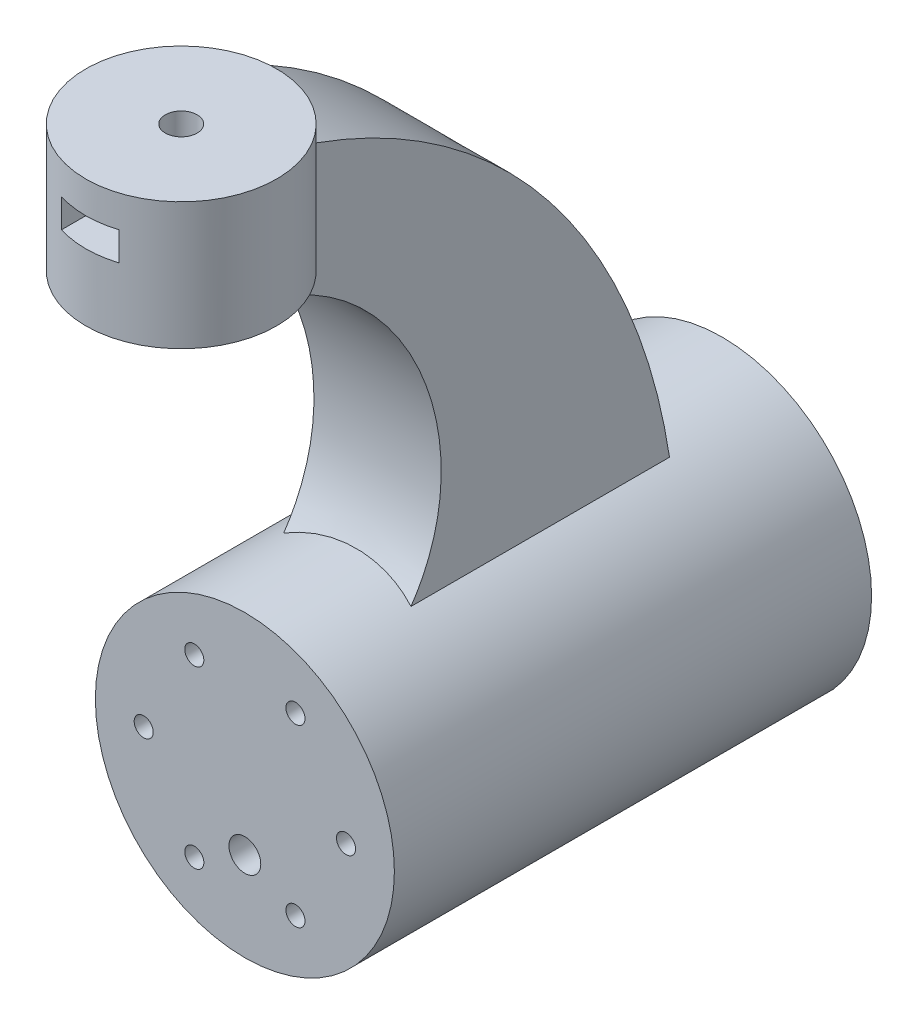
from build123d import *

# Parameters (mm, degrees)
SKETCH3_R           = 15
BOSS_EXTRUDE1_DEPTH = 20
SKETCH4_R           = 2.5
CUT_EXTRUDE1_DEPTH  = 30.154759474
CUT_EXTRUDE2_DEPTH  = 4.5
SKETCH7_W           = 9
SKETCH7_H           = 4.5
CUT_EXTRUDE3_DEPTH  = 30.154759474
BOSS_EXTRUDE3_DEPTH = 10
SKETCH9_R           = 2.5
CUT_EXTRUDE4_DEPTH  = 30
SKETCH12_R          = 23.5
BOSS_EXTRUDE6_DEPTH = 75
SKETCH13_R          = 19
CUT_EXTRUDE6_DEPTH  = 143.195288401
SKETCH14_R          = 19
BOSS_EXTRUDE7_DEPTH = 5
SKETCH15_R          = 1.5
SKETCH15_R_2        = 2.5
CUT_EXTRUDE8_DEPTH  = 5


with BuildPart() as part:
    # Sketch3 → Boss-Extrude1 (new body)
    with BuildSketch(Plane(origin=(0, 0, 0), x_dir=(1, 0, 0), z_dir=(0, 1, 0))):
        with Locations(Location((0, 0, 0), (0, 0, 270))):
            Circle(SKETCH3_R)
    extrude(amount=-BOSS_EXTRUDE1_DEPTH)

    # Sketch4 → Cut-Extrude1 (cut, through all)
    with BuildSketch(Plane(origin=(0, 0, 0), x_dir=(1, 0, 0), z_dir=(0, 1, 0))):
        with Locations(Location((0, 0, 0), (0, 0, 270))):
            Circle(SKETCH4_R)
    extrude(amount=-CUT_EXTRUDE1_DEPTH, mode=Mode.SUBTRACT)

    # Sketch6 → Cut-Extrude2 (cut)
    with BuildSketch(Plane(origin=(0, -5, 0), x_dir=(1, 0, 0), z_dir=(0, 1, 0))):
        Polygon((4.5, -2.598076211), (4.5, 2.598076211), (0, 5.196152423), (-4.5, 2.598076211), (-4.5, -2.598076211), (0, -5.196152423), align=None)
    extrude(amount=-CUT_EXTRUDE2_DEPTH, mode=Mode.SUBTRACT)

    # Sketch7 → Cut-Extrude3 (cut, through all)
    with BuildSketch(Plane.XY):
        with Locations((0, -7.25)):
            Rectangle(SKETCH7_W, SKETCH7_H)
    extrude(amount=CUT_EXTRUDE3_DEPTH, mode=Mode.SUBTRACT)

    # Sketch8 → Boss-Extrude3 (add, symmetric)
    with BuildSketch(Plane(origin=(0, 0, 0), x_dir=(0, 0, -1), z_dir=(1, 0, 0))):
        with BuildLine():
            Line((0, 0), (0, -20))
            add(Edge.make_bspline(
                [(0, -20), (27.284263103, -24.07033424), (42.456200025, -63.400009775), (20, -80)],
                knots=[0, 0, 0, 0, 1, 1, 1, 1], degree=3))
            Line((20, -80), (67.5, -80))
            add(Edge.make_bspline(
                [(0, 0), (41.415251378, -8.894775063), (64.240572417, -43.774170089), (67.5, -80)],
                knots=[0, 0, 0, 0, 1, 1, 1, 1], degree=3))
        make_face()
    extrude(amount=BOSS_EXTRUDE3_DEPTH, both=True)

    # Sketch9 → Cut-Extrude4 (cut)
    with BuildSketch(Plane(origin=(0, 0, 0), x_dir=(1, 0, 0), z_dir=(0, 1, 0))):
        with Locations(Location((0, 0, 0), (0, 0, 270))):
            Circle(SKETCH9_R)
    extrude(amount=-CUT_EXTRUDE4_DEPTH, mode=Mode.SUBTRACT)

    # Sketch12 → Boss-Extrude6 (add)
    with BuildSketch(Plane.XY.offset(-10)):
        with Locations((0, -95)):
            Circle(SKETCH12_R)
    extrude(amount=-BOSS_EXTRUDE6_DEPTH)

    # Sketch13 → Cut-Extrude6 (cut, through all)
    with BuildSketch(Plane.XY.offset(-10)):
        with Locations((0, -95)):
            Circle(SKETCH13_R)
    extrude(amount=-CUT_EXTRUDE6_DEPTH, mode=Mode.SUBTRACT)

    # Sketch14 → Boss-Extrude7 (add)
    with BuildSketch(Plane.XY.offset(-10)):
        with Locations((0, -95)):
            Circle(SKETCH14_R)
    extrude(amount=-BOSS_EXTRUDE7_DEPTH)

    # Sketch15 → Cut-Extrude8 (cut)
    with BuildSketch(Plane.XY.offset(-10)):
        with Locations((15.9, -95)):
            Circle(SKETCH15_R)
        with Locations((7.95, -108.76980392)):
            Circle(SKETCH15_R)
        with Locations((-7.95, -108.76980392)):
            Circle(SKETCH15_R)
        with Locations((-15.9, -95)):
            Circle(SKETCH15_R)
        with Locations((-7.95, -81.23019608)):
            Circle(SKETCH15_R)
        with Locations((7.95, -81.23019608)):
            Circle(SKETCH15_R)
        with Locations((0, -104.5)):
            Circle(SKETCH15_R_2)
    extrude(amount=-CUT_EXTRUDE8_DEPTH, mode=Mode.SUBTRACT)


solid = part.part
